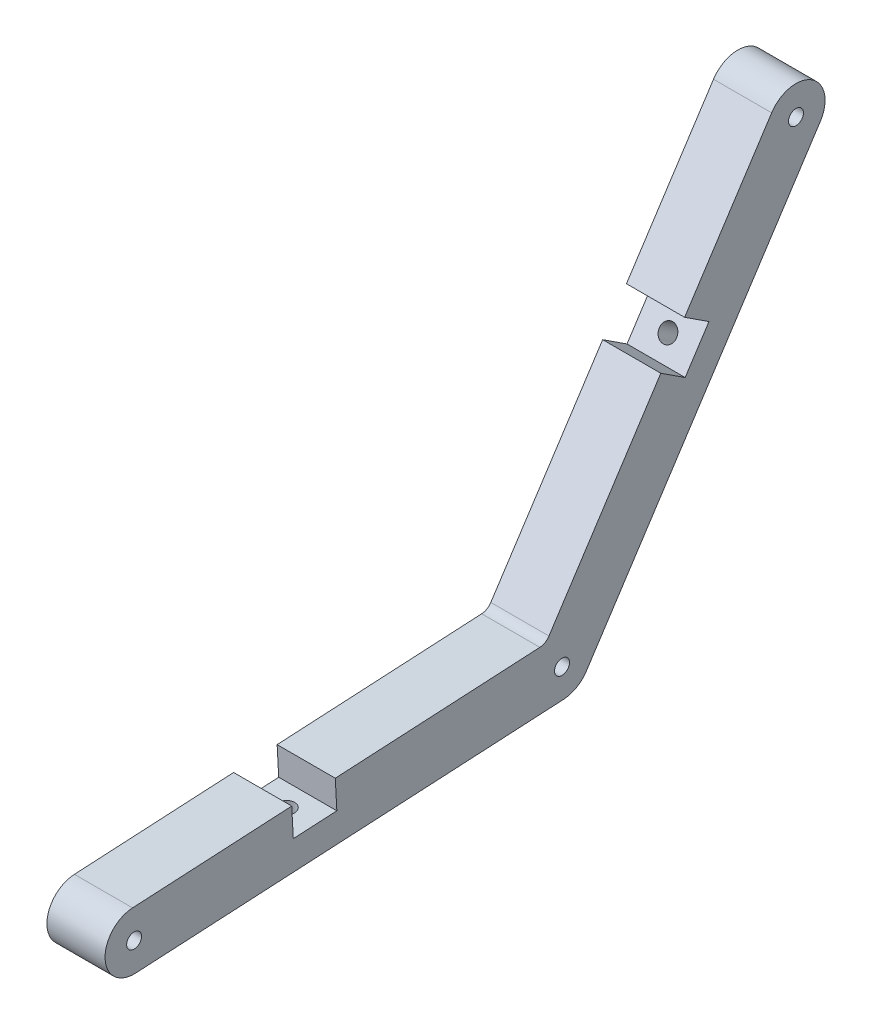
from build123d import *

# Parameters (mm, degrees)
BOSS_EXTRUDE1_DEPTH        = 12.7
CUT_EXTRUDE1_DEPTH         = 132.57770374
AXEL_HOLES_D               = 3.2639
MOUNTING_HOLES_D           = 3.7973
MOUNTING_HOLES_ON_FACE_2_D = 3.7973
FILLET1_R                  = 2.54


with BuildPart() as part:
    # Sketch1 → Boss-Extrude1 (new body)
    with BuildSketch(Plane(origin=(0, 0, 0), x_dir=(0, 0, -1), z_dir=(1, 0, 0))):
        with BuildLine():
            Line((-93.814317406, 1.29451642), (-3.560533752, 6.167025361))
            Line((-3.560533752, 6.167025361), (45.786074597, 81.892840322))
            ThreePointArc((45.786074597, 81.892840322), (54.573019473, 83.746107639), (56.42628679, 74.959162763))
            Line((56.42628679, 74.959162763), (5.320106096, -3.46683878))
            ThreePointArc((5.320106096, -3.46683878), (3.175, -5.499261314), (0.342317406, -6.34076642))
            Line((0.342317406, -6.34076642), (-93.129682594, -11.38701642))
            ThreePointArc((-93.129682594, -11.38701642), (-99.81276642, -5.388567406), (-93.814317406, 1.29451642))
        make_face()
    extrude(amount=BOSS_EXTRUDE1_DEPTH)

    # Sketch2 → Cut-Extrude1 (cut, through all)
    with BuildSketch(Plane(origin=(12.7, 0, 0), x_dir=(0, 0, -1), z_dir=(1, 0, 0))):
        Polygon((-59.042239928, 3.171748061), (-58.699922522, -3.169018359), (-49.188772892, -2.65554225), (-49.531090298, 3.68522417), align=None)
        Polygon((21.574047399, 44.73779456), (26.894153496, 41.270955781), (32.094411665, 49.251114925), (26.774305568, 52.717953705), align=None)
    extrude(amount=-CUT_EXTRUDE1_DEPTH, mode=Mode.SUBTRACT)

    # Axel Holes (through all)
    with Locations(Plane(origin=(12.7, -5.04625, 93.472), x_dir=(0, 0, 1), z_dir=(1, 0, 0))):
        with Locations((0, 0), (-93.472, -5.04625), (-144.578180694, -83.472251543)):
            Hole(AXEL_HOLES_D / 2)

    # Mounting Holes (through all)
    with Locations(Plane(origin=(6.35, -2.912280304, 53.944347707), x_dir=(0, -0.053908252869, 0.998545892923), z_dir=(0, 0.998545892923, 0.053908252869))):
        with Locations((0, 0)):
            Hole(MOUNTING_HOLES_D / 2)

    # Mounting Holes on face 2 (through all)
    with Locations(Plane(origin=(6.35, 45.261035353, -29.49428258), x_dir=(0, 0.837811925843, -0.545958951676), z_dir=(0, 0.545958951676, 0.837811925843))):
        with Locations((0, 0)):
            Hole(MOUNTING_HOLES_ON_FACE_2_D / 2)

    # Fillet1
    fillet1_edges = [part.edges().sort_by_distance(p)[0] for p in [
        (6.35, 6.167025361, 3.560533752),
    ]]
    fillet(fillet1_edges, radius=FILLET1_R)


solid = part.part
